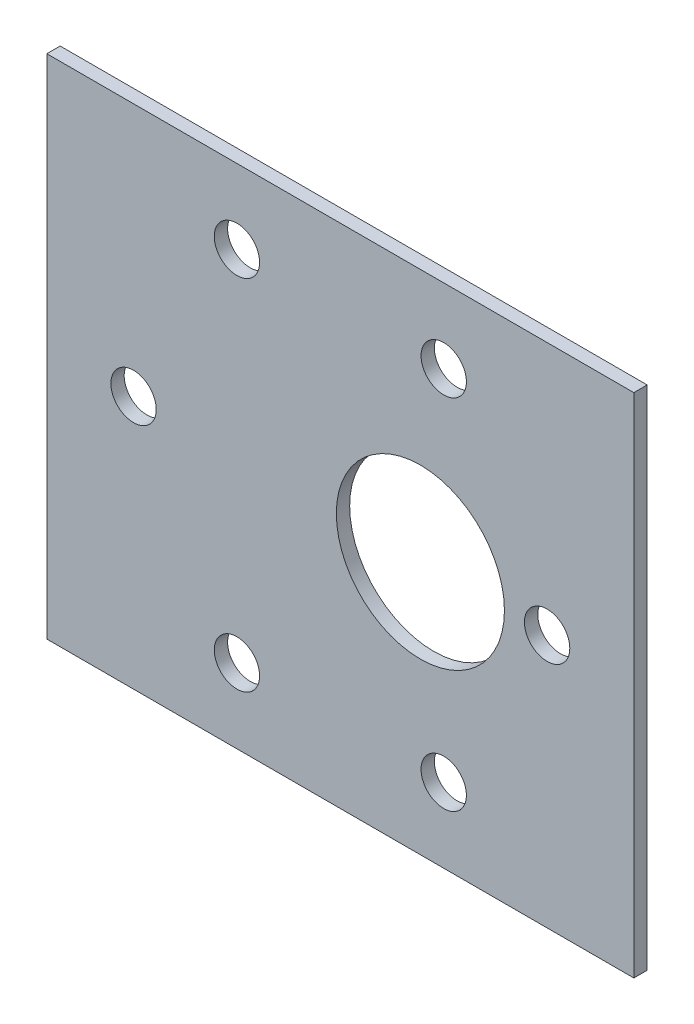
from build123d import *

# Parameters (mm, degrees)
OFFSET_HOUSING_PATTERN_AND_SHAFT_BORE_PR_W   = 44
OFFSET_HOUSING_PATTERN_AND_SHAFT_BORE_PR_H   = 38
OFFSET_HOUSING_PATTERN_AND_SHAFT_BORE_PR_R   = 6.3
OFFSET_HOUSING_PATTERN_AND_SHAFT_BORE_PR_R_2 = 1.7
OFFSET_HOUSING_PATTERN_AND_SHAFT_BORE_DEPTH  = 1


with BuildPart() as part:
    # Offset housing pattern and shaft bore profile → Offset housing pattern and shaft bore (new body)
    with BuildSketch(Plane.XY):
        with Locations((-6, 28.5)):
            Rectangle(OFFSET_HOUSING_PATTERN_AND_SHAFT_BORE_PR_W, OFFSET_HOUSING_PATTERN_AND_SHAFT_BORE_PR_H)
        with Locations((0, 28.5)):
            Circle(OFFSET_HOUSING_PATTERN_AND_SHAFT_BORE_PR_R, mode=Mode.SUBTRACT)
        with Locations((9.5, 28.5)):
            Circle(OFFSET_HOUSING_PATTERN_AND_SHAFT_BORE_PR_R_2, mode=Mode.SUBTRACT)
        with Locations((1.75, 41.923393759)):
            Circle(OFFSET_HOUSING_PATTERN_AND_SHAFT_BORE_PR_R_2, mode=Mode.SUBTRACT)
        with Locations((-13.75, 41.923393759)):
            Circle(OFFSET_HOUSING_PATTERN_AND_SHAFT_BORE_PR_R_2, mode=Mode.SUBTRACT)
        with Locations((-21.5, 28.5)):
            Circle(OFFSET_HOUSING_PATTERN_AND_SHAFT_BORE_PR_R_2, mode=Mode.SUBTRACT)
        with Locations((-13.75, 15.076606241)):
            Circle(OFFSET_HOUSING_PATTERN_AND_SHAFT_BORE_PR_R_2, mode=Mode.SUBTRACT)
        with Locations((1.75, 15.076606241)):
            Circle(OFFSET_HOUSING_PATTERN_AND_SHAFT_BORE_PR_R_2, mode=Mode.SUBTRACT)
    extrude(amount=OFFSET_HOUSING_PATTERN_AND_SHAFT_BORE_DEPTH)


solid = part.part
